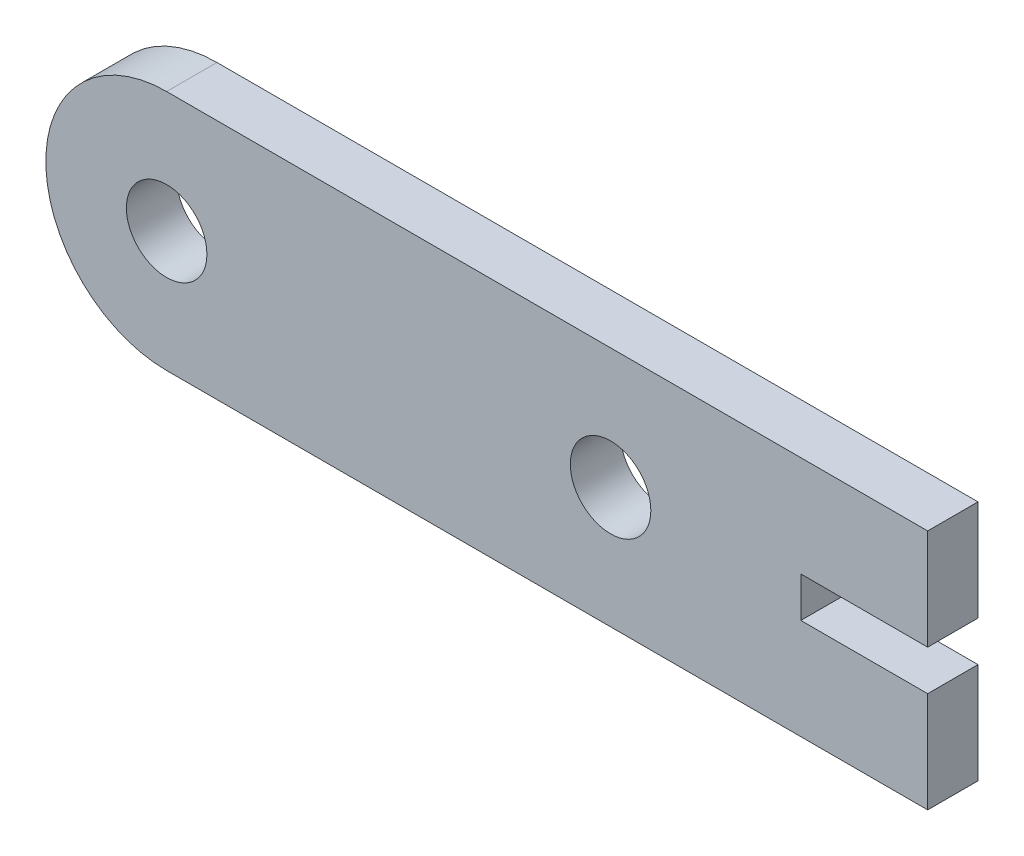
from build123d import *

# Parameters (mm, degrees)
SKETCH1_R           = 6.35
BOSS_EXTRUDE1_DEPTH = 7.9375


with BuildPart() as part:
    # Sketch1 → Boss-Extrude1 (new body)
    with BuildSketch(Plane.XY):
        with BuildLine():
            Line((0, 19.05), (120, 19.05))
            Line((120, 19.05), (120, 3.175))
            Line((120, 3.175), (100, 3.175))
            Line((100, 3.175), (100, -3.175))
            Line((100, -3.175), (120, -3.175))
            Line((120, -3.175), (120, -19.05))
            Line((120, -19.05), (0, -19.05))
            ThreePointArc((0, -19.05), (-19.05, 0), (0, 19.05))
        make_face()
        Circle(SKETCH1_R, mode=Mode.SUBTRACT)
        with Locations((70, 0)):
            Circle(SKETCH1_R, mode=Mode.SUBTRACT)
    extrude(amount=BOSS_EXTRUDE1_DEPTH)


solid = part.part
